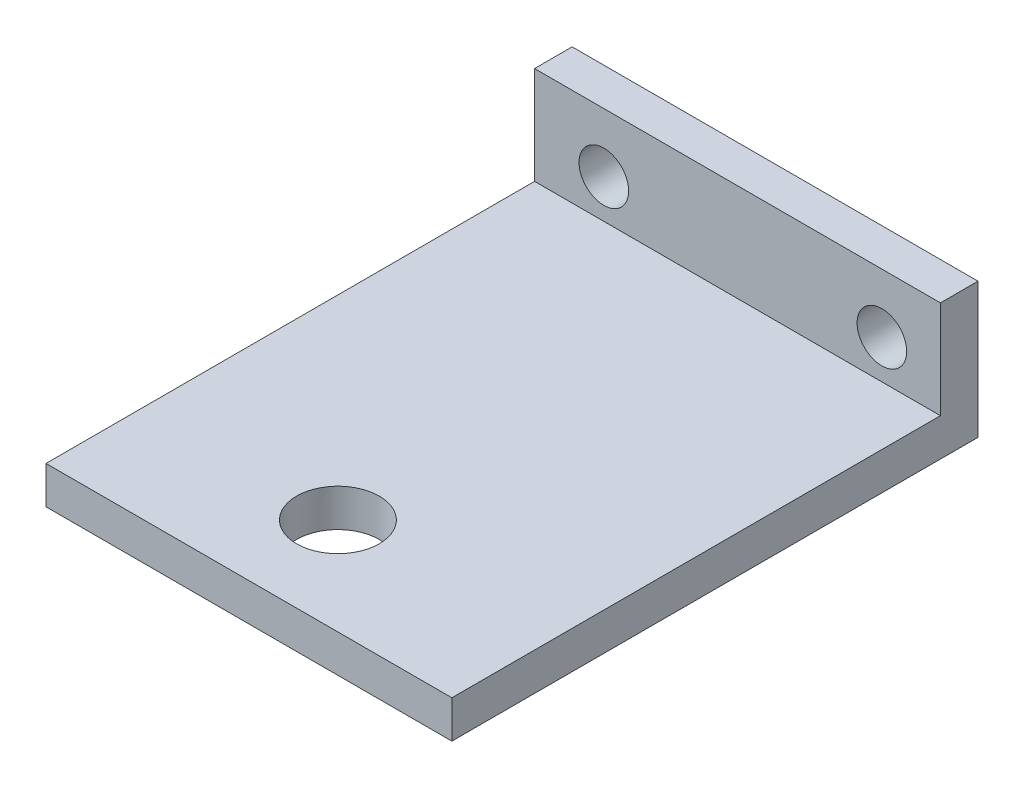
from build123d import *

# Parameters (mm, degrees)
ESQUISSE1_W             = 54
ESQUISSE1_H             = 18
BOSS_EXTRU_1_DEPTH      = 70
ESQUISSE2_W             = 89.885876072
ESQUISSE2_H             = 74.564815434
ENL_V_MAT_EXTRU_1_DEPTH = 13
M6_CLEARANCE_HOLE1_D    = 6.6
M10_CLEARANCE_HOLE1_D   = 11


with BuildPart() as part:
    # Esquisse1 → Boss.-Extru.1 (new body)
    with BuildSketch(Plane.XY):
        Rectangle(ESQUISSE1_W, ESQUISSE1_H)
    extrude(amount=BOSS_EXTRU_1_DEPTH)

    # Esquisse2 → Enlèv. mat.-Extru.1 (cut)
    with BuildSketch(Plane(origin=(0, 9, 0), x_dir=(1, 0, 0), z_dir=(0, 1, 0))):
        with Locations((-2.437014962, -42.282407717)):
            Rectangle(ESQUISSE2_W, ESQUISSE2_H)
    extrude(amount=-ENL_V_MAT_EXTRU_1_DEPTH, mode=Mode.SUBTRACT)

    # M6 Clearance Hole1 (through all)
    with Locations(Plane.XY.offset(5)):
        with Locations((19.211630693, 1.144746785), (-17.782403657, 1.144746785)):
            Hole(M6_CLEARANCE_HOLE1_D / 2)

    # M10 Clearance Hole1 (through all)
    with Locations(Plane(origin=(0, -9, 0), x_dir=(-1, 0, 0), z_dir=(0, -1, 0))):
        with Locations((1.06980506, -57.092210499)):
            Hole(M10_CLEARANCE_HOLE1_D / 2)


solid = part.part
